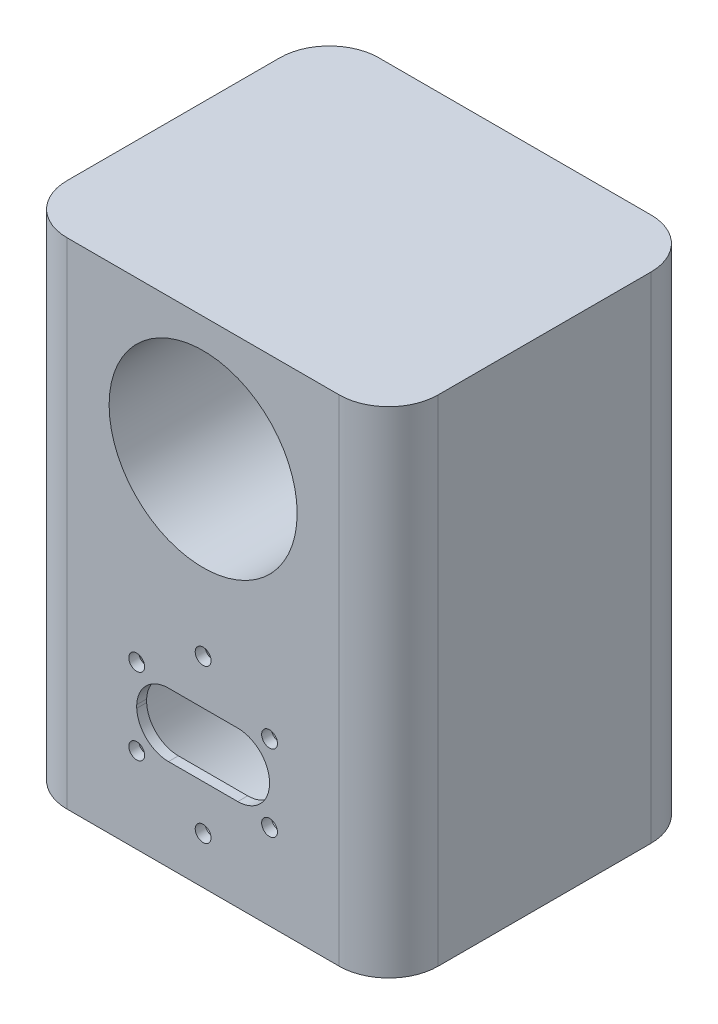
from build123d import *

# Parameters (mm, degrees)
EXTRUDE_1_DEPTH      = 100
SKETCH_4_R           = 1.6
CUT_EXTRUDE_7_DEPTH  = 124.99697577
SKETCH_7_R           = 19
CUT_EXTRUDE_8_DEPTH  = 61
SKETCH_3_R           = 1.6
CUT_EXTRUDE_9_DEPTH  = 124.99697577
SKETCH_5_R           = 19
CUT_EXTRUDE_10_DEPTH = 61


with BuildPart() as part:
    # 草图1 → 凸台-拉伸1 (new body)
    with BuildSketch(Plane(origin=(0, 0, 0), x_dir=(1, 0, 0), z_dir=(0, 1, 0))):
        with BuildLine():
            Line((-27.5, 31.5), (27.5, 31.5))
            ThreePointArc((27.5, 31.5), (34.571067812, 28.571067812), (37.5, 21.5))
            Line((37.5, 21.5), (37.5, -21.5))
            ThreePointArc((37.5, -21.5), (34.571067812, -28.571067812), (27.5, -31.5))
            Line((27.5, -31.5), (-27.5, -31.5))
            ThreePointArc((-27.5, -31.5), (-34.571067812, -28.571067812), (-37.5, -21.5))
            Line((-37.5, -21.5), (-37.5, 21.5))
            ThreePointArc((-37.5, 21.5), (-34.571067812, 28.571067812), (-27.5, 31.5))
        make_face()
    extrude(amount=-EXTRUDE_1_DEPTH)

    # 草图4 → 切除-拉伸7 (cut, through all)
    with BuildSketch(Plane(origin=(0, 0, -31.5), x_dir=(-1, 0, 0), z_dir=(0, 0, -1))):
        with Locations((0, -90.500000002)):
            Circle(SKETCH_4_R)
        with Locations((13.42339376, -82.750000001)):
            Circle(SKETCH_4_R)
        with BuildLine():
            ThreePointArc((7, -81.427584506), (11.429921133, -79.657213904), (13.419546961, -75.321340016))
            ThreePointArc((13.419546961, -75.321340016), (13.42339376, -75), (13.419546961, -74.678659984))
            ThreePointArc((13.419546961, -74.678659984), (11.429921133, -70.342786096), (7, -68.572415494))
            Line((7, -68.572415494), (-7, -68.572415494))
            ThreePointArc((-7, -68.572415494), (-11.429921133, -70.342786096), (-13.419546961, -74.678659984))
            ThreePointArc((-13.419546961, -74.678659984), (-13.42339376, -75), (-13.419546961, -75.321340016))
            ThreePointArc((-13.419546961, -75.321340016), (-11.429921133, -79.657213904), (-7, -81.427584506))
            Line((-7, -81.427584506), (7, -81.427584506))
        make_face()
        with Locations((-13.42339376, -82.750000001)):
            Circle(SKETCH_4_R)
        with Locations((13.42339376, -67.249999999)):
            Circle(SKETCH_4_R)
        with Locations((-13.42339376, -67.249999999)):
            Circle(SKETCH_4_R)
        with Locations((0, -59.499999998)):
            Circle(SKETCH_4_R)
    extrude(amount=-CUT_EXTRUDE_7_DEPTH, mode=Mode.SUBTRACT)

    # 草图7 → 切除-拉伸8 (cut)
    with BuildSketch(Plane(origin=(0, 0, -31.5), x_dir=(-1, 0, 0), z_dir=(0, 0, -1))):
        with Locations((0, -75)):
            Circle(SKETCH_7_R)
    extrude(amount=-CUT_EXTRUDE_8_DEPTH, mode=Mode.SUBTRACT)

    # 草图3 → 切除-拉伸9 (cut, through all)
    with BuildSketch(Plane.XY.offset(31.5)):
        with Locations((0.004610011, -41.094795393)):
            Circle(SKETCH_3_R)
        with Locations((13.428003771, -33.344795392)):
            Circle(SKETCH_3_R)
        with BuildLine():
            ThreePointArc((7.004610011, -32.022379898), (11.434531144, -30.252009295), (13.424156972, -25.916135407))
            ThreePointArc((13.424156972, -25.916135407), (13.428003771, -25.594795392), (13.424156972, -25.273455376))
            ThreePointArc((13.424156972, -25.273455376), (11.434531144, -20.937581488), (7.004610011, -19.167210885))
            Line((7.004610011, -19.167210885), (-6.995389989, -19.167210885))
            ThreePointArc((-6.995389989, -19.167210885), (-11.425311121, -20.937581488), (-13.414936949, -25.273455376))
            ThreePointArc((-13.414936949, -25.273455376), (-13.418783749, -25.594795392), (-13.414936949, -25.916135407))
            ThreePointArc((-13.414936949, -25.916135407), (-11.425311121, -30.252009295), (-6.995389989, -32.022379898))
            Line((-6.995389989, -32.022379898), (7.004610011, -32.022379898))
        make_face()
        with Locations((-13.418783749, -33.344795392)):
            Circle(SKETCH_3_R)
        with Locations((13.428003771, -17.844795391)):
            Circle(SKETCH_3_R)
        with Locations((-13.418783749, -17.844795391)):
            Circle(SKETCH_3_R)
        with Locations((0.004610011, -10.09479539)):
            Circle(SKETCH_3_R)
    extrude(amount=-CUT_EXTRUDE_9_DEPTH, mode=Mode.SUBTRACT)

    # 草图5 → 切除-拉伸10 (cut)
    with BuildSketch(Plane.XY.offset(31.5)):
        with Locations((0, -25)):
            Circle(SKETCH_5_R)
    extrude(amount=-CUT_EXTRUDE_10_DEPTH, mode=Mode.SUBTRACT)


solid = part.part
